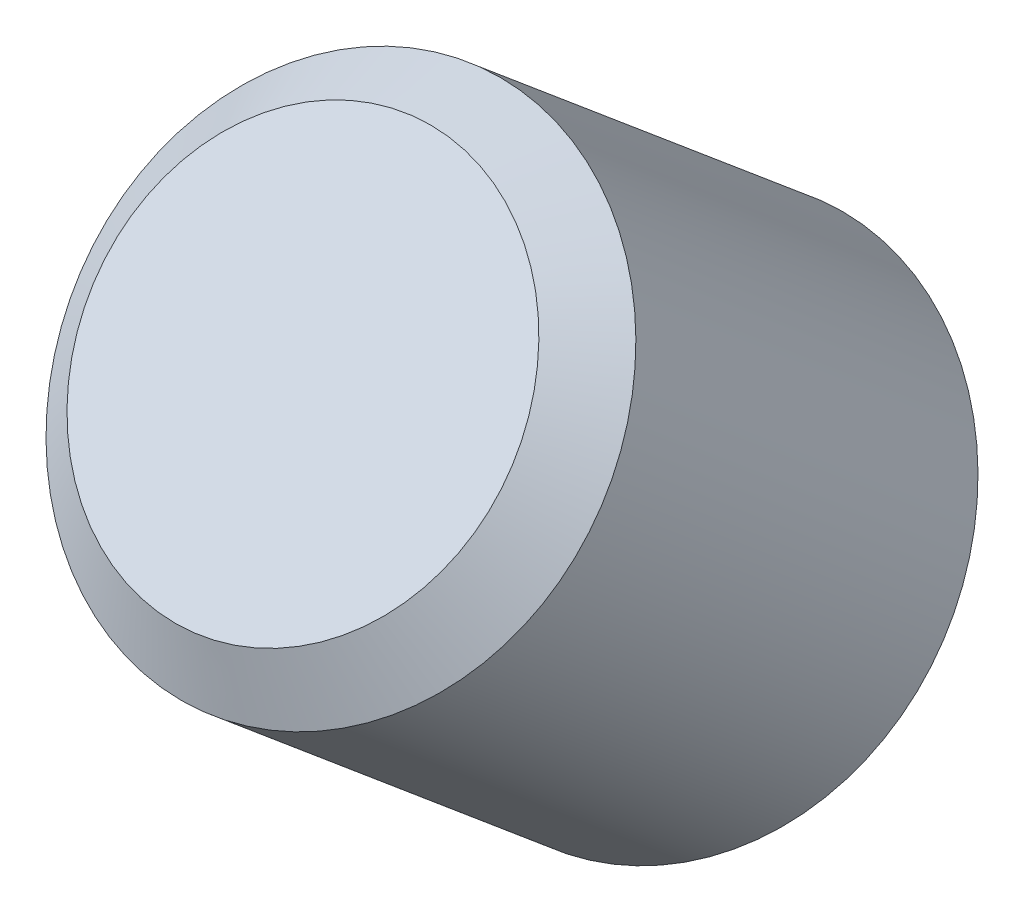
from build123d import *

# Parameters (mm, degrees)
SKETCH2_R           = 5
BOSS_EXTRUDE1_DEPTH = 10
SKETCH3_R           = 5
BOSS_EXTRUDE2_DEPTH = 1
CHAMFER1_SIZE       = 1


with BuildPart() as part:
    # Sketch2 → Boss-Extrude1 (new body)
    with BuildSketch(Plane(origin=(0, 4.567005967, 5.442745768), x_dir=(1, 0, 0), z_dir=(0, 0.6427876096865435, 0.7660444431189747))):
        with Locations(Location((37.184001138, 70.413914347, 0), (0, 0, 270))):
            Circle(SKETCH2_R)
        with BuildLine():
            Line((38.784001138, 67.758730476), (38.784001138, 73.069098218))
            ThreePointArc((38.784001138, 73.069098218), (34.084000914, 70.413914347), (38.784001138, 67.758730476))
        make_face(mode=Mode.SUBTRACT)
    extrude(amount=BOSS_EXTRUDE1_DEPTH)

    # Sketch3 → Boss-Extrude2 (add)
    with BuildSketch(Plane(origin=(0, 10.994882064, 13.1031902), x_dir=(1, 0, 0), z_dir=(0, 0.6427876096865434, 0.7660444431189747))):
        with Locations(Location((37.184001138, 70.413914347, 0), (0, 0, 270))):
            Circle(SKETCH3_R)
    extrude(amount=BOSS_EXTRUDE2_DEPTH)

    # Chamfer1
    chamfer1_edges = [part.edges().sort_by_distance(p)[0] for p in [
        (37.184001138, 69.408079693, -34.605895097),
        (37.184001138, 62.337415986, -43.032383972),
    ]]
    chamfer(chamfer1_edges, length=CHAMFER1_SIZE)


solid = part.part
